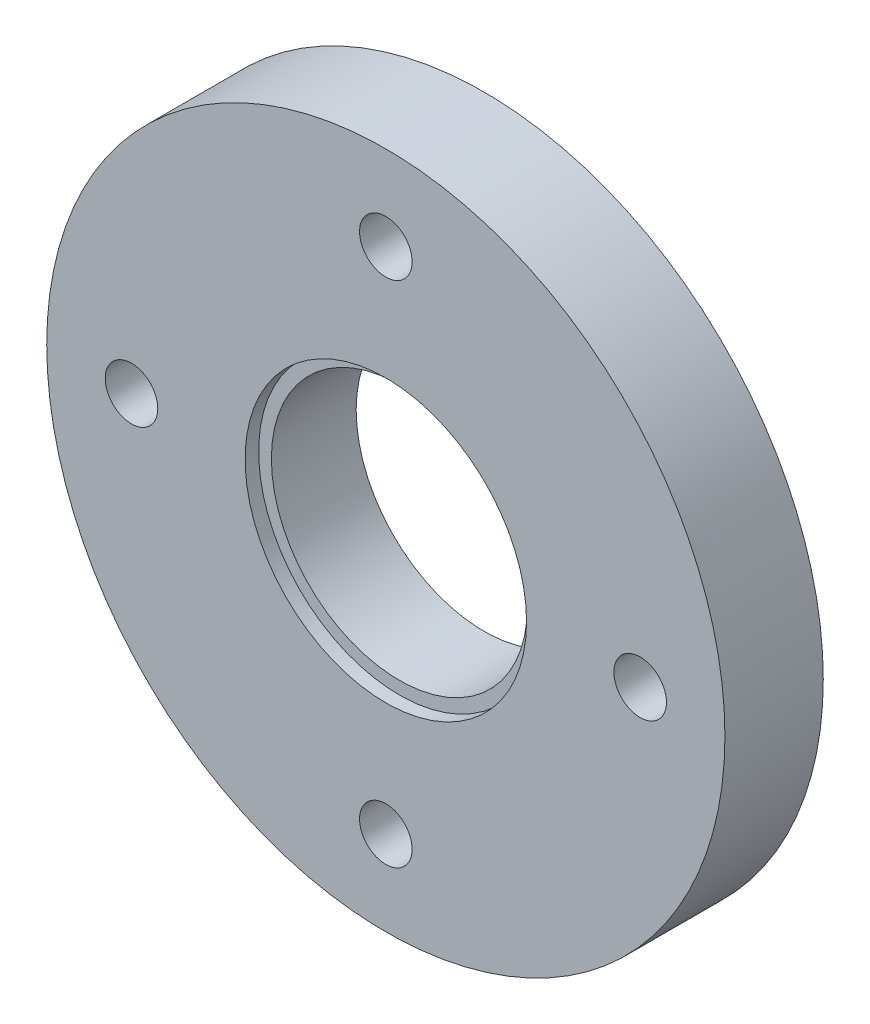
from build123d import *

# Parameters (mm, degrees)
SKETCH_1_R          = 20
SKETCH_1_R_2        = 7.55
SKETCH_1_R_3        = 1.55
EXTRUDE_1_DEPTH     = 5.8
SKETCH_2_R          = 8.3
CUT_EXTRUDE_1_DEPTH = 0.8


with BuildPart() as part:
    # ｽｹｯﾁ1 → ﾎﾞｽ - 押し出し1 (new body)
    with BuildSketch(Plane.XY):
        Circle(SKETCH_1_R)
        Circle(SKETCH_1_R_2, mode=Mode.SUBTRACT)
        with Locations((0, 15)):
            Circle(SKETCH_1_R_3, mode=Mode.SUBTRACT)
        with Locations((15, 0)):
            Circle(SKETCH_1_R_3, mode=Mode.SUBTRACT)
        with Locations((0, -15)):
            Circle(SKETCH_1_R_3, mode=Mode.SUBTRACT)
        with Locations((-15, 0)):
            Circle(SKETCH_1_R_3, mode=Mode.SUBTRACT)
    extrude(amount=EXTRUDE_1_DEPTH)

    # ｽｹｯﾁ2 → ｶｯﾄ - 押し出し1 (cut)
    with BuildSketch(Plane.XY.offset(5.8)):
        Circle(SKETCH_2_R)
    extrude(amount=-CUT_EXTRUDE_1_DEPTH, mode=Mode.SUBTRACT)


solid = part.part
